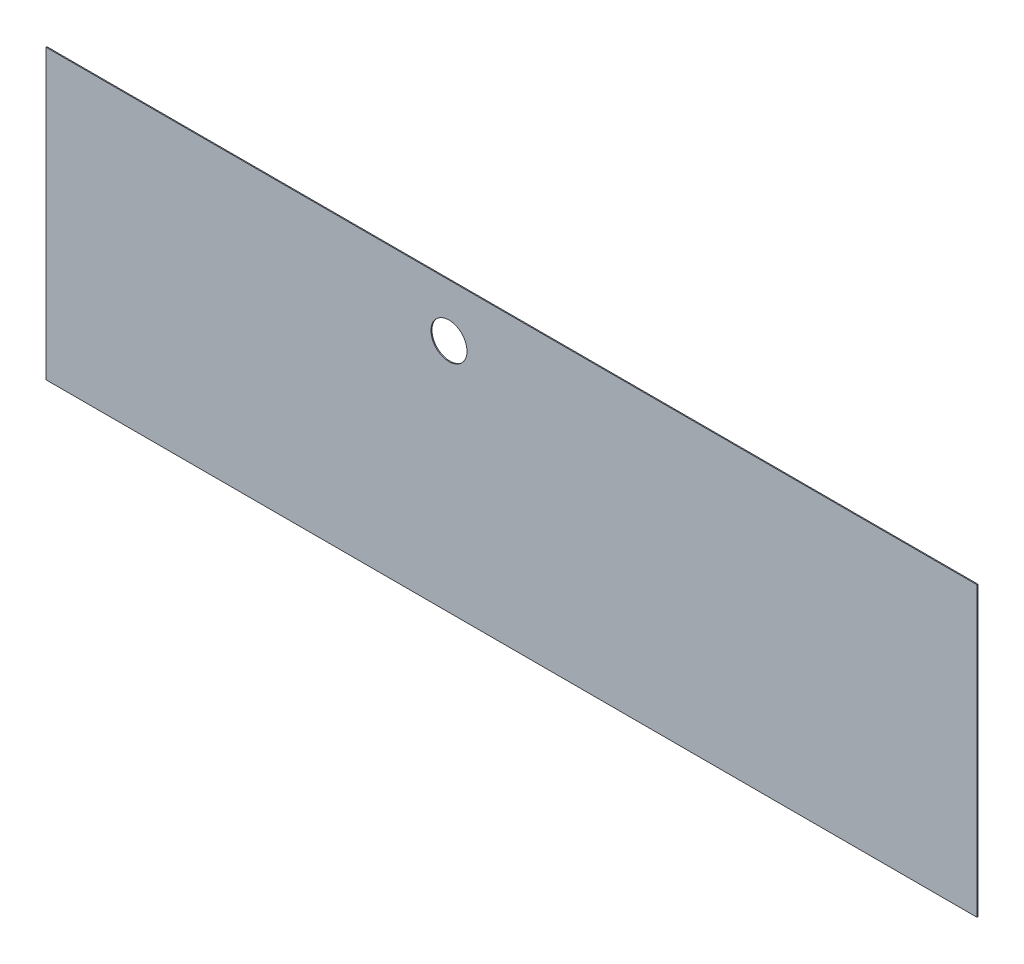
from build123d import *

# Parameters (mm, degrees)
CROQUIS1_W            = 1939.5
CROQUIS1_H            = 600
EXTRUIR1_DEPTH        = 2
CROQUIS2_R            = 37.5
CORTAR_EXTRUIR1_DEPTH = 10


with BuildPart() as part:
    # Croquis1 → Extruir1 (new body)
    with BuildSketch(Plane.XY):
        Rectangle(CROQUIS1_W, CROQUIS1_H)
    extrude(amount=EXTRUIR1_DEPTH)

    # Croquis2 → Cortar-Extruir1 (cut)
    with BuildSketch(Plane(origin=(0, 0, 0), x_dir=(-1, 0, 0), z_dir=(0, 0, -1))):
        with Locations((130.25, 190)):
            Circle(CROQUIS2_R)
    extrude(amount=-CORTAR_EXTRUIR1_DEPTH, mode=Mode.SUBTRACT)


solid = part.part
